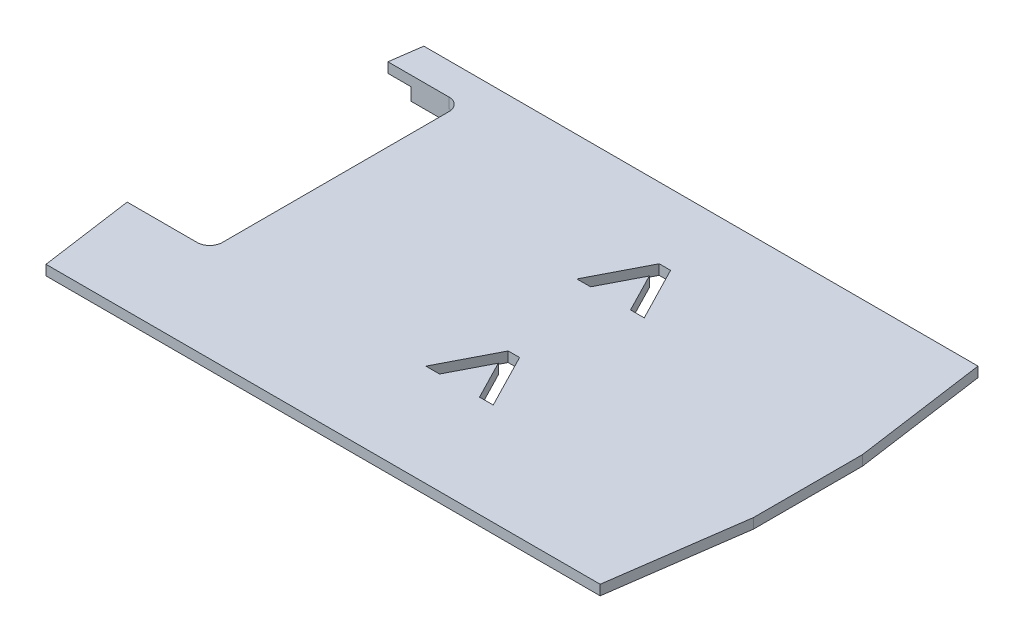
from build123d import *

# Parameters (mm, degrees)
BOSS_EXTRUDE1_DEPTH = 0.8
SKETCH2_W           = 9.888461937
SKETCH2_H           = 20
CUT_EXTRUDE1_DEPTH  = 0.8
FILLET1_R           = 1
BOSS_EXTRUDE2_DEPTH = 1
SKETCH4_W           = 5
SKETCH4_H           = 1
BOSS_EXTRUDE3_DEPTH = 1
FILLET2_R           = 1
CUT_EXTRUDE2_DEPTH  = 10


with BuildPart() as part:
    # Sketch1 → Boss-Extrude1 (new body)
    with BuildSketch(Plane(origin=(0, 0, 0), x_dir=(1, 0, 0), z_dir=(0, 1, 0))):
        Polygon((-22, 15), (-23.5, 4.326945416), (-23.5, -4.326945416), (-22, -15), (22, -15), (23.5, -4.326945416), (23.5, 4.326945416), (22, 15), align=None)
    extrude(amount=BOSS_EXTRUDE1_DEPTH)

    # Sketch2 → Cut-Extrude1 (cut)
    with BuildSketch(Plane(origin=(0, 0.8, 0), x_dir=(1, 0, 0), z_dir=(0, 1, 0))):
        with Locations((-21.444230969, 2.5)):
            Rectangle(SKETCH2_W, SKETCH2_H)
    extrude(amount=-CUT_EXTRUDE1_DEPTH, mode=Mode.SUBTRACT)

    # Fillet1
    fillet1_edges = [part.edges().sort_by_distance(p)[0] for p in [
        (-16.5, 0.4, 7.5),
    ]]
    fillet(fillet1_edges, radius=FILLET1_R)

    # Sketch3 → Boss-Extrude2 (add)
    with BuildSketch(Plane.XZ):
        Polygon((-19.5, 13.5), (-20.5, 13.5), (-20.5, 12.5), (-20.5, 8.5), (-19.5, 8.5), (-19.5, 12.5), (-15.5, 12.5), (-15.5, 13.5), align=None)
        Polygon((19.5, 13.5), (15.5, 13.5), (15.5, 12.5), (19.5, 12.5), (19.5, 8.5), (20.5, 8.5), (20.5, 12.5), (20.5, 13.5), align=None)
        Polygon((19.5, -13.5), (20.5, -13.5), (20.5, -12.5), (20.5, -8.5), (19.5, -8.5), (19.5, -12.5), (15.5, -12.5), (15.5, -13.5), align=None)
    extrude(amount=BOSS_EXTRUDE2_DEPTH)

    # Sketch4 → Boss-Extrude3 (add)
    with BuildSketch(Plane.XZ):
        with Locations((-18, -13)):
            Rectangle(SKETCH4_W, SKETCH4_H)
    extrude(amount=BOSS_EXTRUDE3_DEPTH)

    # Fillet2
    fillet2_edges = [part.edges().sort_by_distance(p)[0] for p in [
        (-16.5, 0.4, -12.5),
    ]]
    fillet(fillet2_edges, radius=FILLET2_R)

    # Sketch5 → Cut-Extrude2 (cut)
    with BuildSketch(Plane(origin=(0, 0.8, 0), x_dir=(1, 0, 0), z_dir=(0, 1, 0))):
        Polygon((1.1702653, 5.066019343), (0.081403121, 5.066019343), (2.306192784, 9.380762933), (3.209337816, 9.380762933), (5.432855444, 5.066019343), (4.3452653, 5.066019343), (2.7577653, 8.145616699), align=None)
        Polygon((1.1702653, -6.924365272), (0.081403121, -6.924365272), (2.306192784, -2.609621682), (3.209337816, -2.609621682), (5.432855444, -6.924365272), (4.3452653, -6.924365272), (2.7577653, -3.844767916), align=None)
    extrude(amount=-CUT_EXTRUDE2_DEPTH, mode=Mode.SUBTRACT)


solid = part.part
